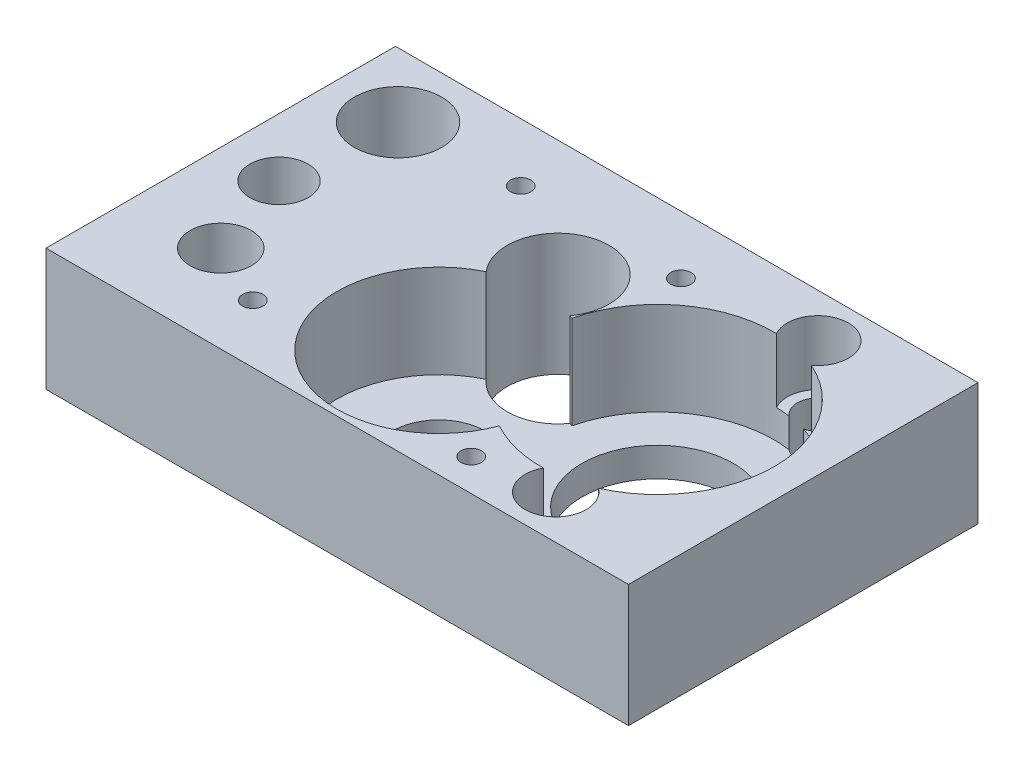
from build123d import *
from build123d.topology import SkipClean

# Parameters (mm, degrees)
SKETCH_1_W          = 20
SKETCH_1_H          = 12
SKETCH_1_R          = 1.75
SKETCH_1_R_2        = 1.6
SKETCH_1_R_3        = 2.6
EXTRUDE_1_DEPTH     = 1
EXTRUDE_START       = 1
SKETCH_1_6_W        = 20
SKETCH_1_6_H        = 12
EXTRUDE_2_DEPTH     = 3.2
SKETCH_4_R          = 0.9
SKETCH_4_R_2        = 0.35
SKETCH_4_R_3        = 0.7
CUT_EXTRUDE_1_DEPTH = 24.698945124
SKETCH_4_3_R        = 1.5
SKETCH_4_3_R_2      = 1
SKETCH_4_3_R_3      = 1.05
CUT_EXTRUDE_4_DEPTH = 2.2


with BuildPart() as part:
    # 草图1 → 凸台-拉伸1 (new body)
    with BuildSketch(Plane(origin=(0, 0, 0), x_dir=(1, 0, 0), z_dir=(0, 1, 0))):
        with Locations((10, -6)):
            Rectangle(SKETCH_1_W, SKETCH_1_H)
        with Locations(Location((9.582575695, -4, 0), (0, 0, 270))):
            Circle(SKETCH_1_R, mode=Mode.SUBTRACT)
        with Locations(Location((9.782588007, -8.295345746, 0), (0, 0, 270))):
            Circle(SKETCH_1_R_2, mode=Mode.SUBTRACT)
        with Locations(Location((15, -6, 0), (0, 0, 270))):
            Circle(SKETCH_1_R_3, mode=Mode.SUBTRACT)
    extrude(amount=EXTRUDE_1_DEPTH)

    # 草图1<6> → 凸台-拉伸2 (add)
    with SkipClean():  # the faces are left unmerged after this step: merging them gives an invalid solid
        with BuildSketch(Plane(origin=(0, 0, 0), x_dir=(1, 0, 0), z_dir=(0, 1, 0)).offset(EXTRUDE_START)):
            with Locations((10, -6)):
                Rectangle(SKETCH_1_6_W, SKETCH_1_6_H)
            with BuildLine():
                ThreePointArc((8.258713369, -5.144503622), (8.971944493, -2.359990995), (11.332575695, -4))
                ThreePointArc((11.332575695, -4), (11.249212779, -4.53368608), (11.007066173, -5.01652687))
                ThreePointArc((11.007066173, -5.01652687), (11.059967321, -5.036772118), (11.112533909, -5.05787082))
                ThreePointArc((11.112533909, -5.05787082), (15.47441313, -2.028233116), (19, -6))
                ThreePointArc((19, -6), (17.033646838, -9.444456494), (13.067859731, -9.502404029))
                ThreePointArc((13.067859731, -9.502404029), (7.432385055, -10.888904322), (8.258713369, -5.144503622))
            make_face(mode=Mode.SUBTRACT)
        extrude(amount=EXTRUDE_2_DEPTH)

    # 草图4 → 切除-拉伸1 (cut, through all)
    with SkipClean():  # the faces are left unmerged after this step: merging them gives an invalid solid
        with BuildSketch(Plane(origin=(0, 4.2, 0), x_dir=(1, 0, 0), z_dir=(0, 1, 0))):
            with Locations(Location((2.3, -2.214171161, 0), (0, 0, 270))):
                Circle(SKETCH_4_R)
            with Locations(Location((6.3, -2, 0), (0, 0, 270))):
                Circle(SKETCH_4_R_2)
            with Locations(Location((5.1, -10, 0), (0, 0, 270))):
                Circle(SKETCH_4_R_2)
            with Locations(Location((11.8, -2, 0), (0, 0, 270))):
                Circle(SKETCH_4_R_2)
            with Locations(Location((2, -6, 0), (0, 0, 270))):
                Circle(SKETCH_4_R_3)
            with Locations(Location((16, -1.5, 0), (0, 0, 270))):
                Circle(SKETCH_4_R_3)
            with Locations(Location((16, -10.5, 0), (0, 0, 270))):
                Circle(SKETCH_4_R_3)
            with Locations(Location((3, -9, 0), (0, 0, 270))):
                Circle(SKETCH_4_R_3)
            with Locations(Location((13.5, -10.9, 0), (0, 0, 270))):
                Circle(SKETCH_4_R_2)
        extrude(amount=-CUT_EXTRUDE_1_DEPTH, mode=Mode.SUBTRACT)

    # 草图4<3> → 切除-拉伸4 (cut)
    with SkipClean():  # the faces are left unmerged after this step: merging them gives an invalid solid
        with BuildSketch(Plane(origin=(0, 4.2, 0), x_dir=(1, 0, 0), z_dir=(0, 1, 0))):
            with Locations(Location((2.3, -2.214171161, 0), (0, 0, 270))):
                Circle(SKETCH_4_3_R)
            with Locations(Location((2, -6, 0), (0, 0, 270))):
                Circle(SKETCH_4_3_R_2)
            with Locations((16, -1.5)):
                Circle(SKETCH_4_3_R_3)
            with Locations((16, -10.5)):
                Circle(SKETCH_4_3_R_3)
            with Locations(Location((3, -9, 0), (0, 0, 270))):
                Circle(SKETCH_4_3_R_3)
        extrude(amount=-CUT_EXTRUDE_4_DEPTH, mode=Mode.SUBTRACT)


solid = part.part
